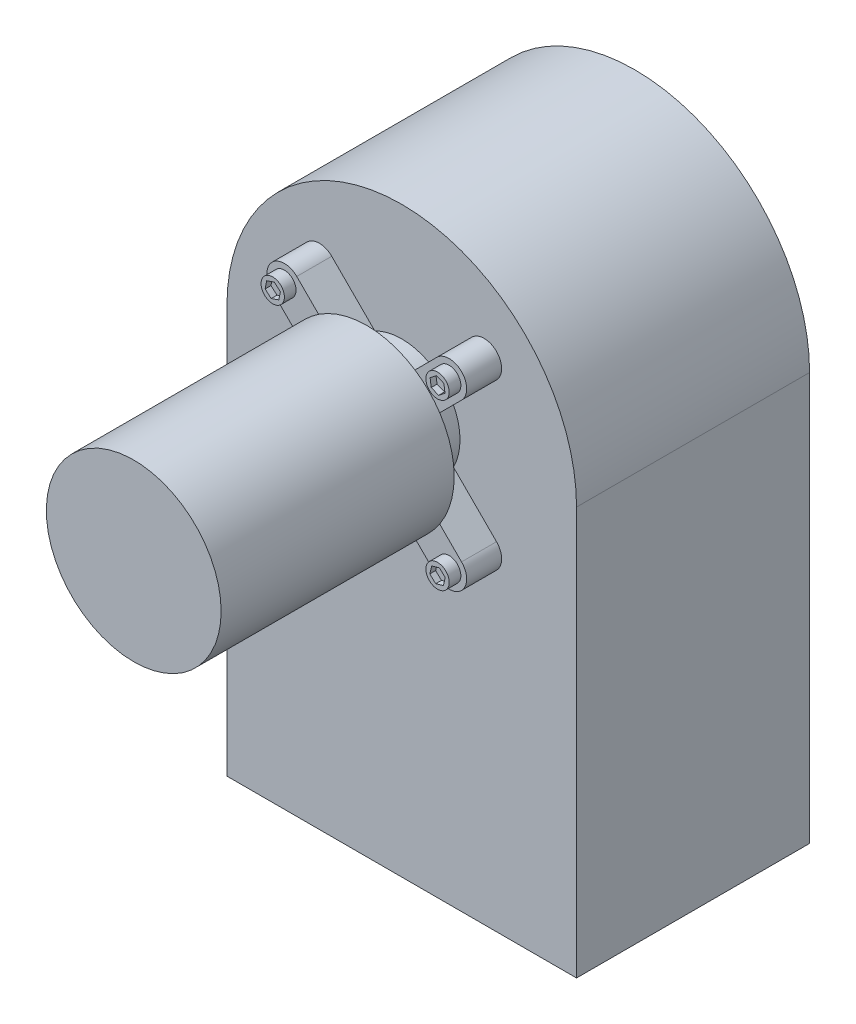
from build123d import *

# Parameters (mm, degrees)
BOSS_EXTRUDE1_DEPTH     = 20
CUT_EXTRUDE1_DEPTH      = 44.011626335
CUT_EXTRUDE1_DEPTH_BACK = 44.011626335
SKETCH2_R               = 4
SKETCH4_R               = 1.5
BOSS_EXTRUDE2_DEPTH     = 3
SKETCH5_R               = 1
BOSS_EXTRUDE3_DEPTH     = 1
CUT_EXTRUDE2_DEPTH      = 0.5
SKETCH7_R               = 7.5
BOSS_EXTRUDE4_DEPTH     = 20


with BuildPart() as part:
    # Sketch1 → Boss-Extrude1 (new body)
    with BuildSketch(Plane.XY):
        with BuildLine():
            ThreePointArc((15, 0), (0, 15), (-15, 0))
            Line((-15, 0), (15, 0))
        make_face()
        with BuildLine():
            Line((15, 0), (-15, 0))
            ThreePointArc((-15, 0), (0, -15), (15, 0))
        make_face()
        with BuildLine():
            ThreePointArc((15, 0), (0, -15), (-15, 0))
            Line((-15, 0), (-15, -35))
            Line((-15, -35), (15, -35))
            Line((15, -35), (15, 0))
        make_face()
    extrude(amount=BOSS_EXTRUDE1_DEPTH)

    # Sketch2 → Cut-Extrude1 (cut, two sides: drawn at the far end of the back side and taken through both)
    with BuildSketch(Plane.XY.offset(20).offset(-CUT_EXTRUDE1_DEPTH_BACK)):
        Circle(SKETCH2_R)
    extrude(amount=CUT_EXTRUDE1_DEPTH + CUT_EXTRUDE1_DEPTH_BACK, mode=Mode.SUBTRACT)


with BuildPart() as body_2:
    # Sketch4 → Boss-Extrude2 (new body)
    with BuildSketch(Plane.XY.offset(20)):
        with Locations((7.071067812, -7.071067812)):
            Circle(SKETCH4_R)
        with BuildLine():
            Line((8.131727984, -6.01040764), (4.433344563, -2.312024219))
            ThreePointArc((4.433344563, -2.312024219), (3.535533906, -3.535533906), (2.312024219, -4.433344563))
            Line((2.312024219, -4.433344563), (6.01040764, -8.131727984))
            ThreePointArc((6.01040764, -8.131727984), (6.01040764, -6.01040764), (8.131727984, -6.01040764))
        make_face()
        with BuildLine():
            ThreePointArc((5, 0), (4.856270319, 1.190226278), (4.433344563, 2.312024219))
            Line((4.433344563, 2.312024219), (3.682682292, 1.561361949))
            ThreePointArc((3.682682292, 1.561361949), (3.919867929, 0.796640079), (4, 0))
            ThreePointArc((4, 0), (3.919867929, -0.796640079), (3.682682292, -1.561361949))
            Line((3.682682292, -1.561361949), (4.433344563, -2.312024219))
            ThreePointArc((4.433344563, -2.312024219), (4.856270319, -1.190226278), (5, 0))
        make_face()
        with BuildLine():
            ThreePointArc((2.312024219, -4.433344563), (3.535533906, -3.535533906), (4.433344563, -2.312024219))
            Line((4.433344563, -2.312024219), (3.682682292, -1.561361949))
            ThreePointArc((3.682682292, -1.561361949), (2.828427125, -2.828427125), (1.561361949, -3.682682292))
            Line((1.561361949, -3.682682292), (2.312024219, -4.433344563))
        make_face()
        with BuildLine():
            Line((-1.561361949, 3.682682292), (-2.312024219, 4.433344563))
            ThreePointArc((-2.312024219, 4.433344563), (-3.535533906, 3.535533906), (-4.433344563, 2.312024219))
            Line((-4.433344563, 2.312024219), (-3.682682292, 1.561361949))
            ThreePointArc((-3.682682292, 1.561361949), (-2.828427125, 2.828427125), (-1.561361949, 3.682682292))
        make_face()
        with BuildLine():
            ThreePointArc((-2.312024219, -4.433344563), (0, -5), (2.312024219, -4.433344563))
            Line((2.312024219, -4.433344563), (1.561361949, -3.682682292))
            ThreePointArc((1.561361949, -3.682682292), (0, -4), (-1.561361949, -3.682682292))
            Line((-1.561361949, -3.682682292), (-2.312024219, -4.433344563))
        make_face()
        with BuildLine():
            Line((3.682682292, 1.561361949), (4.433344563, 2.312024219))
            ThreePointArc((4.433344563, 2.312024219), (3.535533906, 3.535533906), (2.312024219, 4.433344563))
            Line((2.312024219, 4.433344563), (1.561361949, 3.682682292))
            ThreePointArc((1.561361949, 3.682682292), (2.828427125, 2.828427125), (3.682682292, 1.561361949))
        make_face()
        with BuildLine():
            Line((-2.312024219, -4.433344563), (-1.561361949, -3.682682292))
            ThreePointArc((-1.561361949, -3.682682292), (-2.828427125, -2.828427125), (-3.682682292, -1.561361949))
            Line((-3.682682292, -1.561361949), (-4.433344563, -2.312024219))
            ThreePointArc((-4.433344563, -2.312024219), (-3.535533906, -3.535533906), (-2.312024219, -4.433344563))
        make_face()
        with BuildLine():
            Line((-3.682682292, 1.561361949), (-4.433344563, 2.312024219))
            ThreePointArc((-4.433344563, 2.312024219), (-5, 0), (-4.433344563, -2.312024219))
            Line((-4.433344563, -2.312024219), (-3.682682292, -1.561361949))
            ThreePointArc((-3.682682292, -1.561361949), (-4, 0), (-3.682682292, 1.561361949))
        make_face()
        with BuildLine():
            Line((1.561361949, 3.682682292), (2.312024219, 4.433344563))
            ThreePointArc((2.312024219, 4.433344563), (0, 5), (-2.312024219, 4.433344563))
            Line((-2.312024219, 4.433344563), (-1.561361949, 3.682682292))
            ThreePointArc((-1.561361949, 3.682682292), (0, 4), (1.561361949, 3.682682292))
        make_face()
        with BuildLine():
            Line((4.433344563, 2.312024219), (8.131727984, 6.01040764))
            ThreePointArc((8.131727984, 6.01040764), (6.01040764, 6.01040764), (6.01040764, 8.131727984))
            Line((6.01040764, 8.131727984), (2.312024219, 4.433344563))
            ThreePointArc((2.312024219, 4.433344563), (3.535533906, 3.535533906), (4.433344563, 2.312024219))
        make_face()
        with Locations((7.071067812, 7.071067812)):
            Circle(SKETCH4_R)
        with Locations((-7.071067812, 7.071067812)):
            Circle(SKETCH4_R)
        with BuildLine():
            ThreePointArc((-4.433344563, 2.312024219), (-3.535533906, 3.535533906), (-2.312024219, 4.433344563))
            Line((-2.312024219, 4.433344563), (-6.01040764, 8.131727984))
            ThreePointArc((-6.01040764, 8.131727984), (-5.685248513, 7.64509296), (-5.571067812, 7.071067812))
            ThreePointArc((-5.571067812, 7.071067812), (-6.497042663, 5.685248513), (-8.131727984, 6.01040764))
            Line((-8.131727984, 6.01040764), (-4.433344563, 2.312024219))
        make_face()
        with BuildLine():
            Line((-6.01040764, -8.131727984), (-2.312024219, -4.433344563))
            ThreePointArc((-2.312024219, -4.433344563), (-3.535533906, -3.535533906), (-4.433344563, -2.312024219))
            Line((-4.433344563, -2.312024219), (-8.131727984, -6.01040764))
            ThreePointArc((-8.131727984, -6.01040764), (-6.497042663, -5.685248513), (-5.571067812, -7.071067812))
            ThreePointArc((-5.571067812, -7.071067812), (-5.685248513, -7.64509296), (-6.01040764, -8.131727984))
        make_face()
        with Locations((-7.071067812, -7.071067812)):
            Circle(SKETCH4_R)
    extrude(amount=BOSS_EXTRUDE2_DEPTH)

    # Sketch5 → Boss-Extrude3 (add)
    with BuildSketch(Plane.XY.offset(23)):
        with Locations((7.071067812, -7.071067812)):
            Circle(SKETCH5_R)
        with Locations((-7.071067812, -7.071067812)):
            Circle(SKETCH5_R)
        with Locations((-7.071067812, 7.071067812)):
            Circle(SKETCH5_R)
        with Locations((7.071067812, 7.071067812)):
            Circle(SKETCH5_R)
    extrude(amount=BOSS_EXTRUDE3_DEPTH)

    # Sketch6 → Cut-Extrude2 (cut)
    with BuildSketch(Plane.XY.offset(24)):
        Polygon((7.233361769, -6.400017083), (6.571067812, -6.594991758), (6.408773855, -7.266042487), (6.908773855, -7.742118541), (7.571067812, -7.547143866), (7.733361769, -6.876093137), align=None)
        Polygon((-7.317210607, -6.426039027), (-7.752750524, -6.961719333), (-7.506607728, -7.606748118), (-6.824925017, -7.716096597), (-6.3893851, -7.180416291), (-6.635527895, -6.535387506), align=None)
        Polygon((-7.590724774, 7.525606096), (-7.724537994, 6.848300824), (-7.204881032, 6.39376254), (-6.55141085, 6.616529528), (-6.41759763, 7.2938348), (-6.937254592, 7.748373084), align=None)
        Polygon((6.975043436, 7.754754676), (6.430965431, 7.329751695), (6.526989807, 6.646064831), (7.167092188, 6.387380947), (7.711170193, 6.812383929), (7.615145817, 7.496070793), align=None)
    extrude(amount=-CUT_EXTRUDE2_DEPTH, mode=Mode.SUBTRACT)

    # Sketch7 → Boss-Extrude4 (add)
    with BuildSketch(Plane.XY.offset(23)):
        with Locations(Location((0, 0, 0), (0, 0, 213.463040967))):
            Circle(SKETCH7_R)
    extrude(amount=BOSS_EXTRUDE4_DEPTH)


solid = Compound([part.part, body_2.part])
